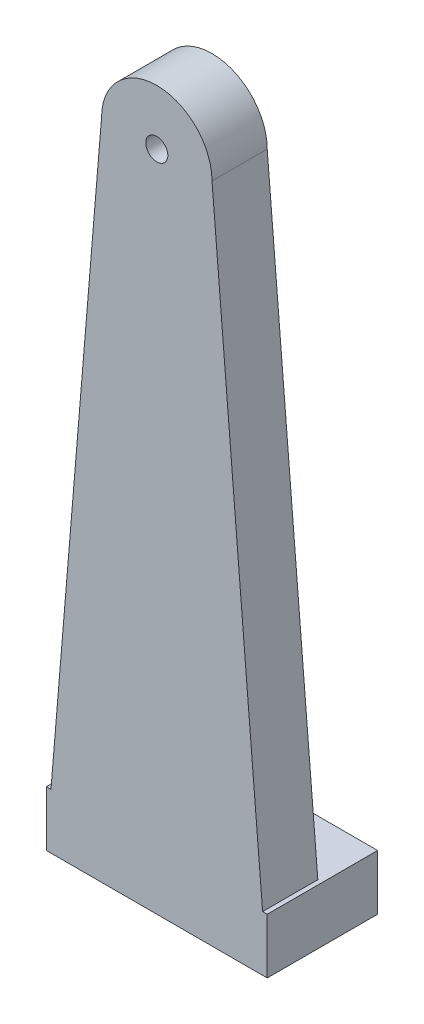
from build123d import *

# Parameters (mm, degrees)
SALIENTE_EXTRUIR1_DEPTH = 5
CROQUIS2_W              = 20
CROQUIS2_H              = 10
SALIENTE_EXTRUIR2_DEPTH = 5
CROQUIS3_R              = 5
CROQUIS3_R_2            = 1
SALIENTE_EXTRUIR4_DEPTH = 5
CROQUIS5_R              = 1
CORTAR_EXTRUIR1_DEPTH   = 5
CROQUIS7_R              = 1
CORTAR_EXTRUIR2_DEPTH   = 5


with BuildPart() as part:
    # Croquis1 → Saliente-Extruir1 (new body)
    with BuildSketch(Plane.XY):
        Polygon((10, -25), (-10, -25), (-5, 35), (5, 35), align=None)
    extrude(amount=SALIENTE_EXTRUIR1_DEPTH)

    # Croquis2 → Saliente-Extruir2 (add)
    with BuildSketch(Plane(origin=(0, -25, 0), x_dir=(-1, 0, 0), z_dir=(0, -1, 0))):
        Rectangle(CROQUIS2_W, CROQUIS2_H)
    extrude(amount=-SALIENTE_EXTRUIR2_DEPTH)

    # Croquis3 → Saliente-Extruir4 (add)
    with BuildSketch(Plane.XY.offset(5)):
        with Locations((0, 35)):
            Circle(CROQUIS3_R)
        with Locations((0, 35)):
            Circle(CROQUIS3_R_2, mode=Mode.SUBTRACT)
    extrude(amount=-SALIENTE_EXTRUIR4_DEPTH)

    # Croquis5 → Cortar-Extruir1 (cut)
    with BuildSketch(Plane.XY.offset(5)):
        with Locations((0, 35)):
            Circle(CROQUIS5_R)
    extrude(amount=-CORTAR_EXTRUIR1_DEPTH, mode=Mode.SUBTRACT)

    # Croquis7 → Cortar-Extruir2 (cut)
    with BuildSketch(Plane.XZ.offset(25)):
        with Locations(Location((0, 0, 0), (0, 0, 270))):
            Circle(CROQUIS7_R)
    extrude(amount=-CORTAR_EXTRUIR2_DEPTH, mode=Mode.SUBTRACT)


solid = part.part
